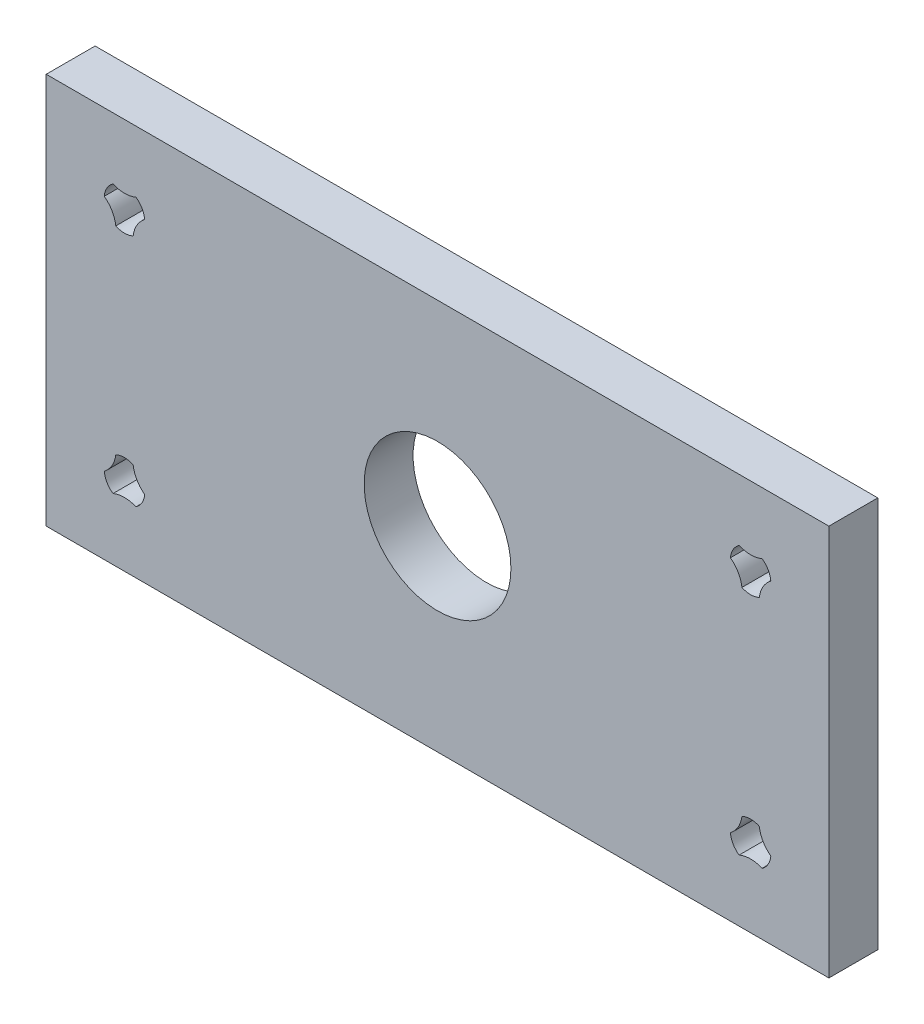
from build123d import *

# Parameters (mm, degrees)
ESQUISSE1_W        = 80
ESQUISSE1_H        = 40
ESQUISSE1_R        = 7.5
ESQUISSE1_R_2      = 2.069624396
BOSS_EXTRU_1_DEPTH = 5


with BuildPart() as part:
    # Esquisse1 → Boss.-Extru.1 (new body)
    # profile 1 of 13: a face of its own
    with BuildSketch(Plane.XY):
        with Locations((0, -3.377163011)):
            Rectangle(ESQUISSE1_W, ESQUISSE1_H)
        with Locations((0, -3.377163011)):
            Circle(ESQUISSE1_R, mode=Mode.SUBTRACT)
        with Locations((32, -15.377163011)):
            Circle(ESQUISSE1_R_2, mode=Mode.SUBTRACT)
        with Locations((-32, 8.622836989)):
            Circle(ESQUISSE1_R_2, mode=Mode.SUBTRACT)
        with Locations((32, 8.622836989)):
            Circle(ESQUISSE1_R_2, mode=Mode.SUBTRACT)
        with Locations((-32, -15.377163011)):
            Circle(ESQUISSE1_R_2, mode=Mode.SUBTRACT)
    # profile 2 of 13: a face of its own
    with BuildSketch(Plane.XY):
        with BuildLine():
            ThreePointArc((-34.062905963, 8.789462695), (-33.792347303, 7.588024791), (-32.887150887, 6.752995165))
            ThreePointArc((-32.887150887, 6.752995165), (-33.267182328, 7.89122893), (-34.062905963, 8.789462695))
        make_face()
    # profile 3 of 13: a face of its own
    with BuildSketch(Plane.XY):
        with BuildLine():
            ThreePointArc((-33.175755077, 10.326053105), (-32, 10.086053105), (-30.824244923, 10.326053105))
            ThreePointArc((-30.824244923, 10.326053105), (-32, 10.692461384), (-33.175755077, 10.326053105))
        make_face()
    # profile 4 of 13: a face of its own
    with BuildSketch(Plane.XY):
        with BuildLine():
            ThreePointArc((-31.112849113, 6.752995165), (-30.250798145, 7.516655263), (-29.930375604, 8.622836989))
            ThreePointArc((-29.930375604, 8.622836989), (-29.932055895, 8.706217537), (-29.937094037, 8.789462695))
            ThreePointArc((-29.937094037, 8.789462695), (-30.732817672, 7.89122893), (-31.112849113, 6.752995165))
        make_face()
    # profile 5 of 13: a face of its own
    with BuildSketch(Plane.XY):
        with BuildLine():
            ThreePointArc((-29.930375604, -15.377163011), (-30.250798145, -14.270981286), (-31.112849113, -13.507321188))
            ThreePointArc((-31.112849113, -13.507321188), (-30.732817672, -14.645554953), (-29.937094037, -15.543788718))
            ThreePointArc((-29.937094037, -15.543788718), (-29.932055895, -15.46054356), (-29.930375604, -15.377163011))
        make_face()
    # profile 6 of 13: a face of its own
    with BuildSketch(Plane.XY):
        with BuildLine():
            ThreePointArc((-34.062905963, -15.543788718), (-33.267182328, -14.645554953), (-32.887150887, -13.507321188))
            ThreePointArc((-32.887150887, -13.507321188), (-33.792347303, -14.342350814), (-34.062905963, -15.543788718))
        make_face()
    # profile 7 of 13: a face of its own
    with BuildSketch(Plane.XY):
        with BuildLine():
            ThreePointArc((-30.824244923, -17.080379128), (-32, -16.840379128), (-33.175755077, -17.080379128))
            ThreePointArc((-33.175755077, -17.080379128), (-32, -17.446787407), (-30.824244923, -17.080379128))
        make_face()
    # profile 8 of 13: a face of its own
    with BuildSketch(Plane.XY):
        with BuildLine():
            ThreePointArc((30.824244923, 10.326053105), (32, 10.086053105), (33.175755077, 10.326053105))
            ThreePointArc((33.175755077, 10.326053105), (32, 10.692461384), (30.824244923, 10.326053105))
        make_face()
    # profile 9 of 13: a face of its own
    with BuildSketch(Plane.XY):
        with BuildLine():
            ThreePointArc((29.937094037, 8.789462695), (30.207652697, 7.588024791), (31.112849113, 6.752995165))
            ThreePointArc((31.112849113, 6.752995165), (30.732817672, 7.89122893), (29.937094037, 8.789462695))
        make_face()
    # profile 10 of 13: a face of its own
    with BuildSketch(Plane.XY):
        with BuildLine():
            ThreePointArc((34.062905963, 8.789462695), (33.267182328, 7.89122893), (32.887150887, 6.752995165))
            ThreePointArc((32.887150887, 6.752995165), (33.749201855, 7.516655263), (34.069624396, 8.622836989))
            ThreePointArc((34.069624396, 8.622836989), (34.067944105, 8.706217537), (34.062905963, 8.789462695))
        make_face()
    # profile 11 of 13: a face of its own
    with BuildSketch(Plane.XY):
        with BuildLine():
            ThreePointArc((34.062905963, -15.543788718), (34.067944105, -15.46054356), (34.069624396, -15.377163011))
            ThreePointArc((34.069624396, -15.377163011), (33.749201855, -14.270981286), (32.887150887, -13.507321188))
            ThreePointArc((32.887150887, -13.507321188), (33.267182328, -14.645554953), (34.062905963, -15.543788718))
        make_face()
    # profile 12 of 13: a face of its own
    with BuildSketch(Plane.XY):
        with BuildLine():
            ThreePointArc((29.937094037, -15.543788718), (30.732817672, -14.645554953), (31.112849113, -13.507321188))
            ThreePointArc((31.112849113, -13.507321188), (30.207652697, -14.342350814), (29.937094037, -15.543788718))
        make_face()
    # profile 13 of 13: a face of its own
    with BuildSketch(Plane.XY):
        with BuildLine():
            ThreePointArc((30.824244923, -17.080379128), (32, -17.446787407), (33.175755077, -17.080379128))
            ThreePointArc((33.175755077, -17.080379128), (32, -16.840379128), (30.824244923, -17.080379128))
        make_face()
    extrude(amount=BOSS_EXTRU_1_DEPTH)


solid = part.part
